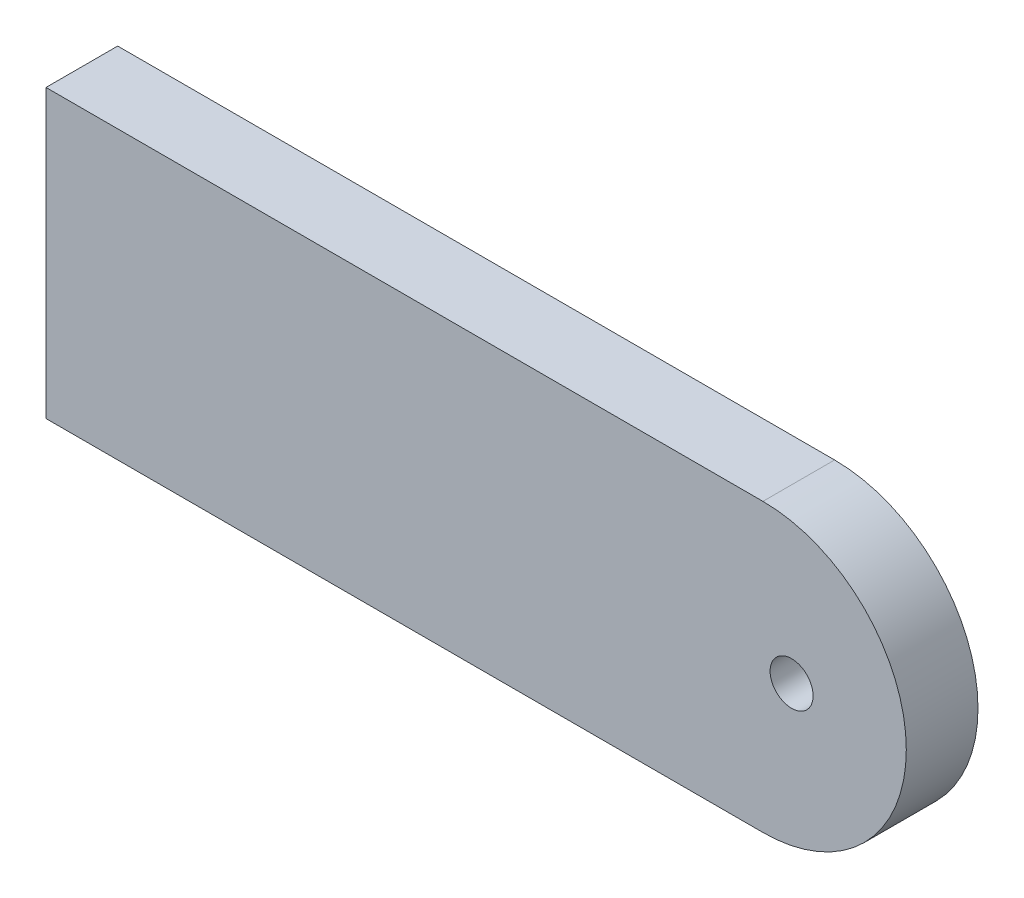
from build123d import *

# Parameters (mm, degrees)
BOSS_EXTRUDE1_DEPTH = 5
SKETCH2_R           = 1.5
CUT_EXTRUDE1_DEPTH  = 5


with BuildPart() as part:
    # Sketch1 → Boss-Extrude1 (new body)
    with BuildSketch(Plane.XY):
        with BuildLine():
            Line((0, 0), (50, 0))
            ThreePointArc((50, 0), (60, 10), (50, 20))
            Line((50, 20), (0, 20))
            Line((0, 20), (0, 0))
        make_face()
    extrude(amount=BOSS_EXTRUDE1_DEPTH)

    # Sketch2 → Cut-Extrude1 (cut)
    with BuildSketch(Plane.XY.offset(5)):
        with Locations((52, 10)):
            Circle(SKETCH2_R)
    extrude(amount=-CUT_EXTRUDE1_DEPTH, mode=Mode.SUBTRACT)


solid = part.part
